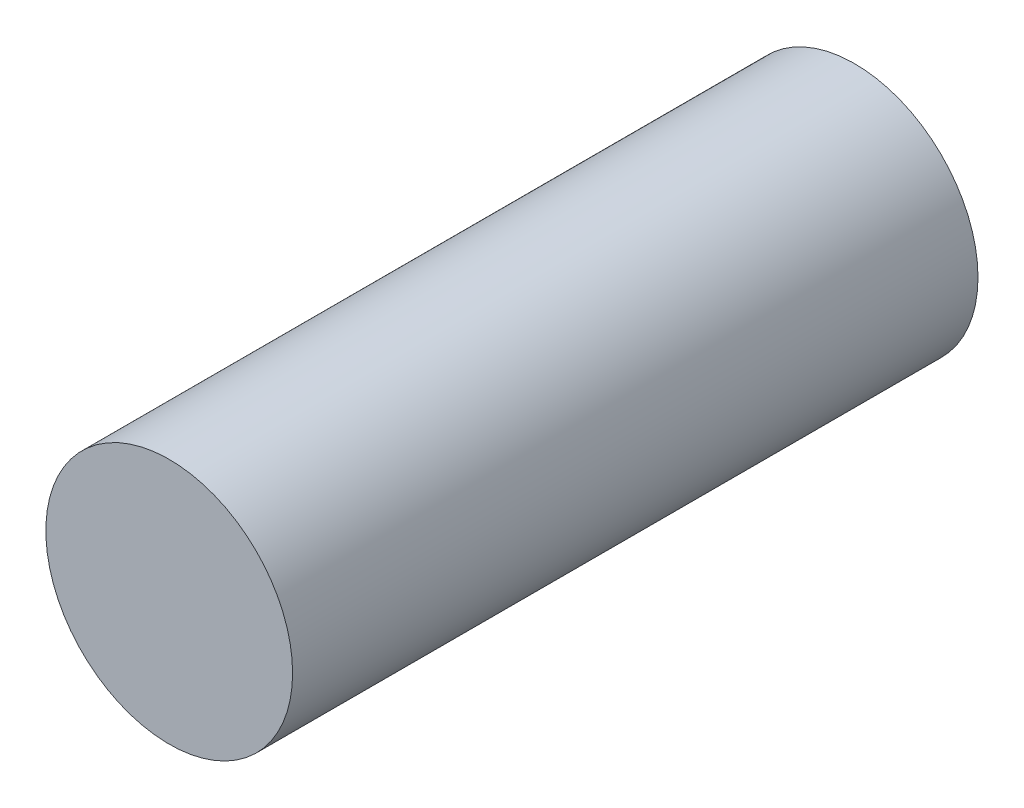
from build123d import *

# Parameters (mm, degrees)
SKETCH1_R           = 2.286
BOSS_EXTRUDE1_DEPTH = 12.7


with BuildPart() as part:
    # Sketch1 → Boss-Extrude1 (new body)
    with BuildSketch(Plane.XY):
        Circle(SKETCH1_R)
    extrude(amount=BOSS_EXTRUDE1_DEPTH)


solid = part.part
